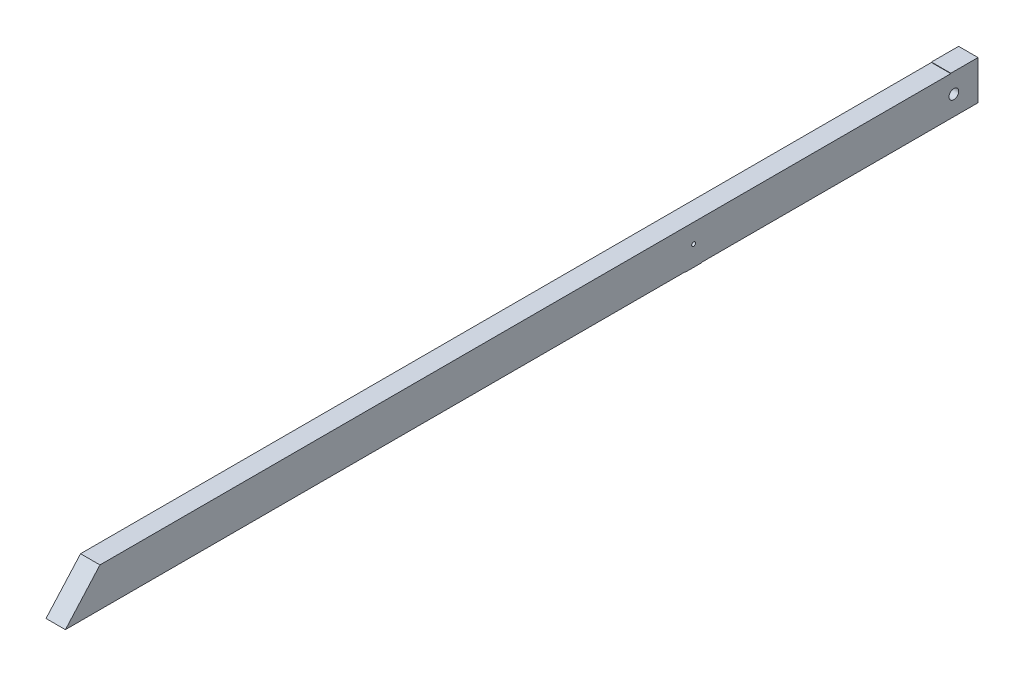
from build123d import *

# Parameters (mm, degrees)
SKETCH1_W           = 50
SKETCH1_H           = 100
BOSS_EXTRUDE1_DEPTH = 2262.74
SKETCH2_W           = 50
SKETCH2_H           = 70.027066898
BOSS_EXTRUDE2_DEPTH = 1
SKETCH3_W           = 50
SKETCH3_H           = 42.703513447
BOSS_EXTRUDE3_DEPTH = 1
SKETCH4_R           = 5
CUT_EXTRUDE1_DEPTH  = 309
SKETCH7_R           = 12.5
CUT_EXTRUDE2_DEPTH  = 100
BOSS_EXTRUDE5_DEPTH = 50


with BuildPart() as part:
    # Sketch1 → Boss-Extrude1 (new body)
    with BuildSketch(Plane.XY):
        with Locations((25, 50)):
            Rectangle(SKETCH1_W, SKETCH1_H)
    extrude(amount=BOSS_EXTRUDE1_DEPTH)

    # Sketch2 → Boss-Extrude2 (add)
    with BuildSketch(Plane(origin=(0, 100, 0), x_dir=(1, 0, 0), z_dir=(0, 1, 0))):
        with Locations((25, -35.013533449)):
            Rectangle(SKETCH2_W, SKETCH2_H)
    extrude(amount=BOSS_EXTRUDE2_DEPTH)

    # Sketch3 → Boss-Extrude3 (add)
    with BuildSketch(Plane.XZ):
        with Locations((25, 732.888243277)):
            Rectangle(SKETCH3_W, SKETCH3_H)
    extrude(amount=BOSS_EXTRUDE3_DEPTH)

    # Sketch4 → Cut-Extrude1 (cut)
    with BuildSketch(Plane(origin=(50, 0, 0), x_dir=(0, 0, -1), z_dir=(1, 0, 0))):
        with Locations((-732.888243277, 51.05890277)):
            Circle(SKETCH4_R)
    extrude(amount=-CUT_EXTRUDE1_DEPTH, mode=Mode.SUBTRACT)

    # Sketch7 → Cut-Extrude2 (cut)
    with BuildSketch(Plane.ZY):
        with Locations((62.269457415, 50.5)):
            Circle(SKETCH7_R)
    extrude(amount=-CUT_EXTRUDE2_DEPTH, mode=Mode.SUBTRACT)

    # Sketch8 → Boss-Extrude5 (add)
    with BuildSketch(Plane(origin=(50, 0, 0), x_dir=(0, 0, -1), z_dir=(1, 0, 0))):
        Polygon((-2262.74, 0), (-2351.764948591, 0), (-2262.74, 100), align=None)
    extrude(amount=-BOSS_EXTRUDE5_DEPTH)


solid = part.part
